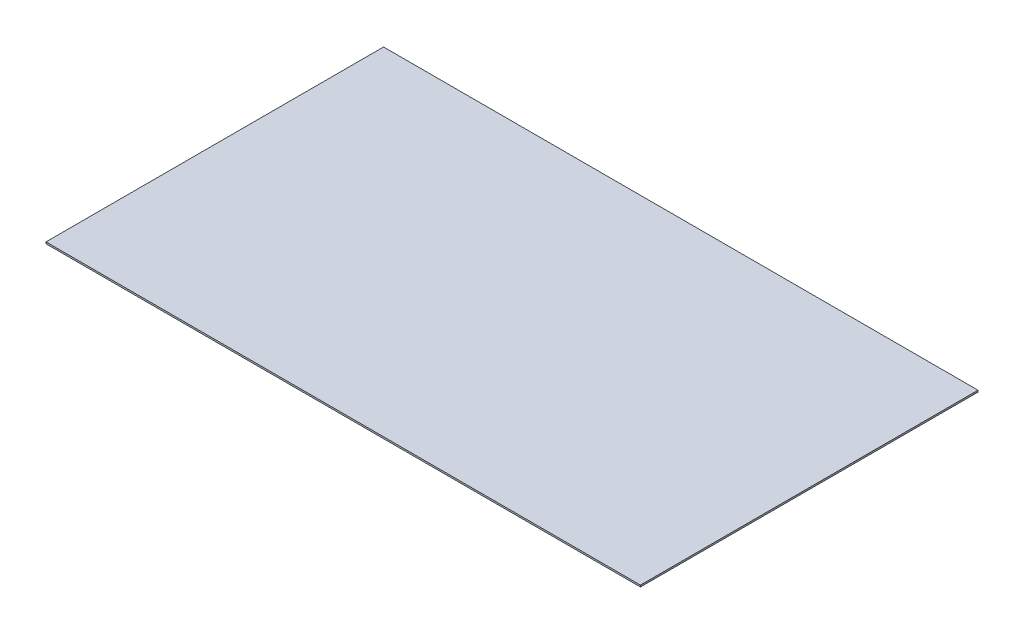
from build123d import *

# Parameters (mm, degrees)
SKETCH1_W           = 562.3
SKETCH1_H           = 319.3
BOSS_EXTRUDE1_DEPTH = 1.5875


with BuildPart() as part:
    # Sketch1 → Boss-Extrude1 (new body)
    with BuildSketch(Plane(origin=(0, 0, 0), x_dir=(1, 0, 0), z_dir=(0, 1, 0))):
        Rectangle(SKETCH1_W, SKETCH1_H)
    extrude(amount=BOSS_EXTRUDE1_DEPTH)


solid = part.part
